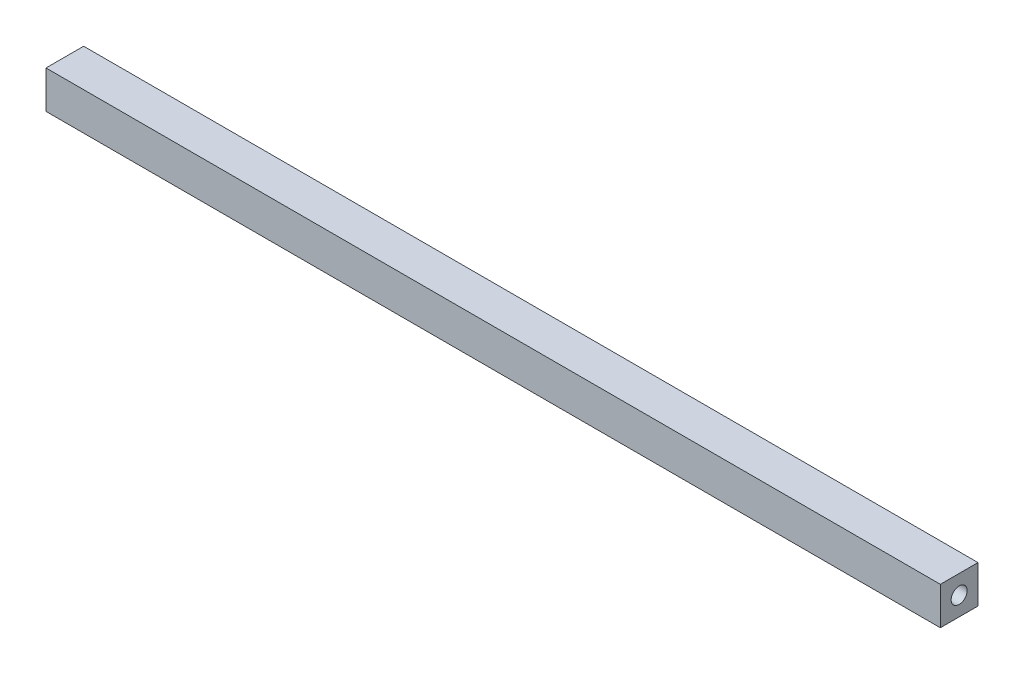
from build123d import *

# Parameters (mm, degrees)
ESBO_O1_W                         = 4
ESBO_O1_H                         = 4
RESSALTO_EXTRUS_O1_DEPTH          = 47.5
CORTE_EXTRUS_O1_REACH             = 97.042
ESBO_O2_R                         = 0.85
CORTE_EXTRUS_O1_DIRECTION_2_DEPTH = 96.042095936


with BuildPart() as part:
    # Esboço1 → Ressalto-extrusão1 (new, symmetric)
    with BuildSketch(Plane(origin=(0, 0, 0), x_dir=(0, 0, -1), z_dir=(1, 0, 0))):
        Rectangle(ESBO_O1_W, ESBO_O1_H)
    extrude(amount=RESSALTO_EXTRUS_O1_DEPTH, both=True)

    # Esboço2 → Corte-extrusão1 (cut, up to next)
    with BuildSketch(Plane(origin=(47.5, 0, 0), x_dir=(0, 0, -1), z_dir=(1, 0, 0)), mode=Mode.PRIVATE) as corte_extrus_o1_sk1:
        with Locations(Location((0, 0, 0), (0, 0, 180))):
            Circle(ESBO_O2_R)
    corte_extrus_o1_tool1 = extrude(corte_extrus_o1_sk1.sketch, amount=-CORTE_EXTRUS_O1_REACH, mode=Mode.PRIVATE) & part.part
    add(corte_extrus_o1_tool1.solids().sort_by_distance((47.5, 0, 0))[0], mode=Mode.SUBTRACT)

    # Esboço2 → Corte-extrusão1 direction 2 (cut)
    with BuildSketch(Plane(origin=(47.5, 0, 0), x_dir=(0, 0, -1), z_dir=(1, 0, 0))):
        with Locations(Location((0, 0, 0), (0, 0, 180))):
            Circle(ESBO_O2_R)
    extrude(amount=CORTE_EXTRUS_O1_DIRECTION_2_DEPTH, mode=Mode.SUBTRACT)


solid = part.part
